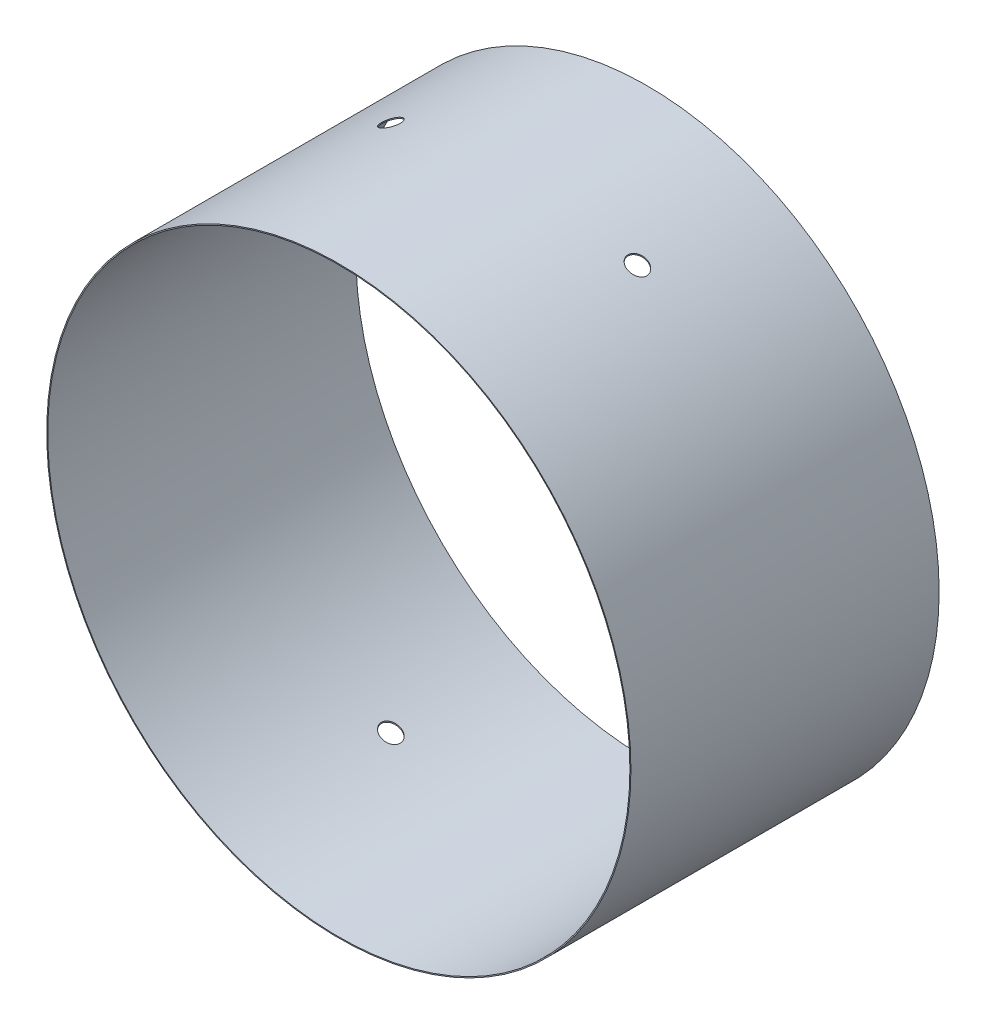
from build123d import *

# Parameters (mm, degrees)
SKETCH1_R               = 426.5
SKETCH1_R_2             = 425
BOSS_EXTRUDE1_DEPTH     = 450
CUT_EXTRUDE1_DEPTH      = 753.532059118
CUT_EXTRUDE1_DEPTH_BACK = 753.532059118
SKETCH2_R               = 13.75


with BuildPart() as part:
    # Sketch1 → Boss-Extrude1 (new body)
    with BuildSketch(Plane.XY):
        Circle(SKETCH1_R)
        Circle(SKETCH1_R_2, mode=Mode.SUBTRACT)
    extrude(amount=BOSS_EXTRUDE1_DEPTH)

    # Sketch2 → Cut-Extrude1 (cut, two sides: drawn at the far end of the back side and taken through both)
    with BuildSketch(Plane(origin=(0, 0, 0), x_dir=(1, 0, 0), z_dir=(0, 1, 0)).offset(-CUT_EXTRUDE1_DEPTH_BACK)):
        with Locations(Location((180, -194, 0), (0, 0, 270))):
            Circle(SKETCH2_R)
        with Locations(Location((-180, -194, 0), (0, 0, 270))):
            Circle(SKETCH2_R)
    extrude(amount=CUT_EXTRUDE1_DEPTH + CUT_EXTRUDE1_DEPTH_BACK, mode=Mode.SUBTRACT)


solid = part.part
